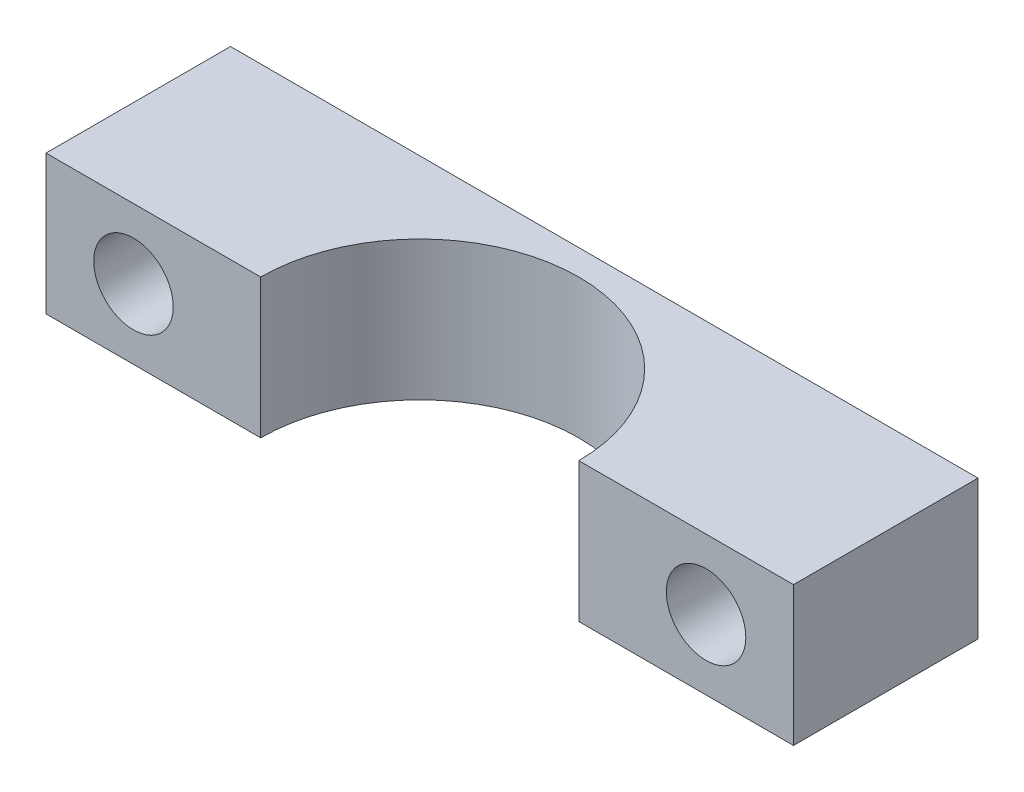
from build123d import *

# Parameters (mm, degrees)
BOSS_EXTRUDE1_DEPTH = 5.5626
SKETCH2_R           = 3.175
CUT_EXTRUDE1_DEPTH  = 34.744605017


with BuildPart() as part:
    # Sketch1 → Boss-Extrude1 (new, symmetric)
    with BuildSketch(Plane(origin=(0, 0, 0), x_dir=(1, 0, 0), z_dir=(0, 1, 0))):
        with BuildLine():
            Line((-12.7, 0), (-29.845, 0))
            Line((-29.845, 0), (-29.845, 14.732))
            Line((-29.845, 14.732), (29.845, 14.732))
            Line((29.845, 14.732), (29.845, 0))
            Line((29.845, 0), (12.7, 0))
            ThreePointArc((12.7, 0), (0, 12.7), (-12.7, 0))
        make_face()
    extrude(amount=BOSS_EXTRUDE1_DEPTH, both=True)

    # Sketch2 → Cut-Extrude1 (cut, through all)
    with BuildSketch(Plane.XY):
        with Locations((-22.86, 0)):
            Circle(SKETCH2_R)
        with Locations((22.86, 0)):
            Circle(SKETCH2_R)
    extrude(amount=-CUT_EXTRUDE1_DEPTH, mode=Mode.SUBTRACT)


solid = part.part
